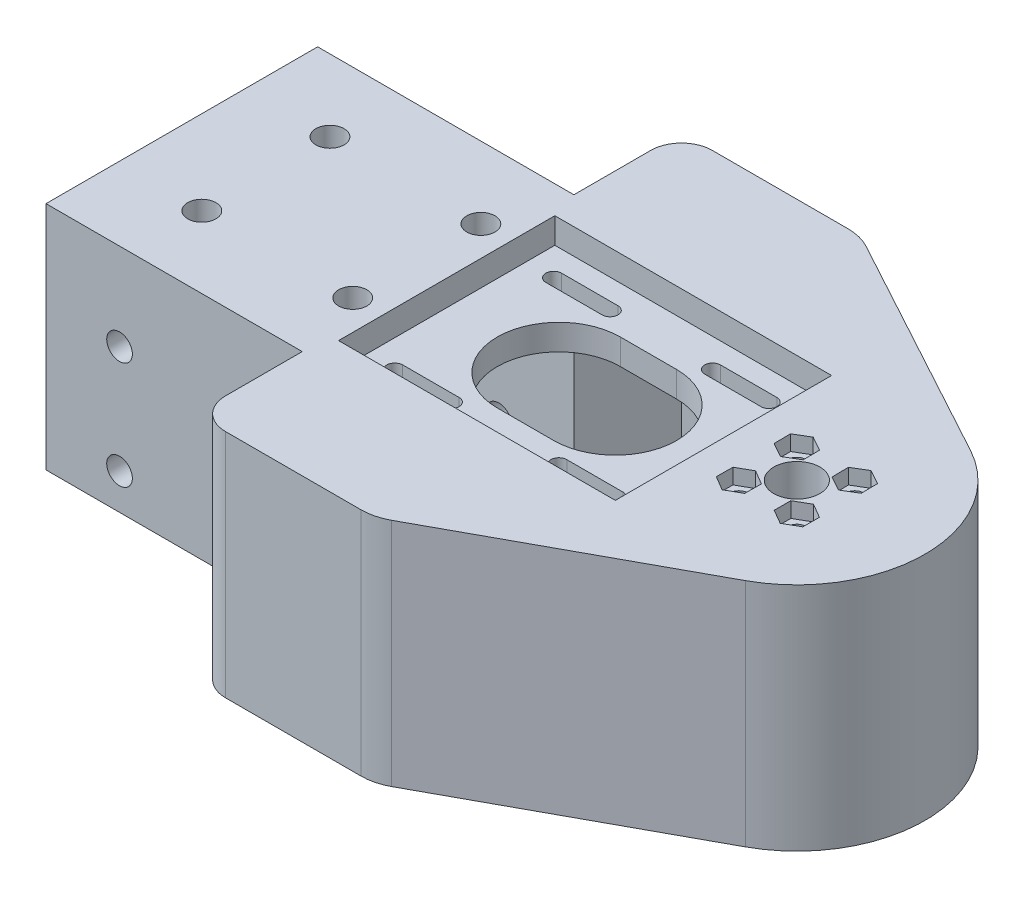
from build123d import *

# Parameters (mm, degrees)
SKETCH1_R           = 4.5
SKETCH1_R_2         = 1.75
BOSS_EXTRUDE1_DEPTH = 10
EXTRUDE_THIN1_START = 35
EXTRUDE_THIN1_DEPTH = 35
FILLET2_R           = 6
EXTRUDE_THIN2_DEPTH = 35
SKETCH7_R           = 2.5
CUT_EXTRUDE2_DEPTH  = 10
CUT_EXTRUDE13_DEPTH = 3
CUT_EXTRUDE5_REACH  = 107.472
SKETCH12_R          = 2.75
CUT_EXTRUDE6_DEPTH  = 2
SKETCH14_W          = 54
SKETCH14_H          = 42.2
CUT_EXTRUDE7_DEPTH  = 5
CUT_EXTRUDE8_REACH  = 105.437
CUT_EXTRUDE10_REACH = 158.545
SKETCH17_W          = 19
SKETCH17_H          = 25
CUT_EXTRUDE12_REACH = 158.545
SKETCH18_R          = 2.55
SKETCH23_R          = 5.5
CUT_EXTRUDE14_DEPTH = 1
CUT_EXTRUDE15_START = -1
SKETCH25_R          = 5.5
CUT_EXTRUDE15_DEPTH = 1
SKETCH26_W          = 10
SKETCH26_H          = 4
BOSS_EXTRUDE2_DEPTH = 7
SKETCH27_W          = 10
SKETCH27_H          = 3
BOSS_EXTRUDE3_DEPTH = 5
CUT_EXTRUDE17_REACH = 128.312
SKETCH29_W          = 20
SKETCH29_H          = 10


with BuildPart() as part:
    # Sketch1 → Boss-Extrude1 (new body)
    with BuildSketch(Plane(origin=(0, 0, 0), x_dir=(1, 0, 0), z_dir=(0, 1, 0))):
        with BuildLine():
            Line((-62.277372263, 21.5), (-62.277372263, -21.5))
            Line((-62.277372263, -21.5), (-62.277372263, -26.5))
            Line((-62.277372263, -26.5), (-57.277372263, -26.5))
            Line((-57.277372263, -26.5), (-12.277372263, -26.5))
            Line((-12.277372263, -26.5), (-12.277372263, -31.5))
            Line((-12.277372263, -31.5), (-12.277372263, -42.5))
            ThreePointArc((-12.277372263, -42.5), (-10.812906169, -46.035533906), (-7.277372263, -47.5))
            Line((-7.277372263, -47.5), (20.178642107, -47.5))
            ThreePointArc((20.178642107, -47.5), (22.644097944, -47.191311961), (24.957342434, -46.284305504))
            Line((24.957342434, -46.284305504), (69.669378554, -21.96076376))
            ThreePointArc((69.669378554, -21.96076376), (82.722627737, 0), (69.669378554, 21.96076376))
            Line((69.669378554, 21.96076376), (24.957342434, 46.284305504))
            ThreePointArc((24.957342434, 46.284305504), (22.644097944, 47.191311961), (20.178642107, 47.5))
            Line((20.178642107, 47.5), (-7.277372263, 47.5))
            ThreePointArc((-7.277372263, 47.5), (-10.812906169, 46.035533906), (-12.277372263, 42.5))
            Line((-12.277372263, 42.5), (-12.277372263, 31.5))
            Line((-12.277372263, 31.5), (-12.277372263, 26.5))
            Line((-12.277372263, 26.5), (-17.277372263, 26.5))
            Line((-17.277372263, 26.5), (-57.277372263, 26.5))
            Line((-57.277372263, 26.5), (-62.277372263, 26.5))
            Line((-62.277372263, 26.5), (-62.277372263, 21.5))
        make_face()
        with Locations(Location((57.722627737, 0, 0), (0, 0, 270))):
            Circle(SKETCH1_R, mode=Mode.SUBTRACT)
        with Locations(Location((52.065773488, -5.656854249, 0), (0, 0, 270))):
            Circle(SKETCH1_R_2, mode=Mode.SUBTRACT)
        with Locations(Location((63.379481987, 5.656854249, 0), (0, 0, 270))):
            Circle(SKETCH1_R_2, mode=Mode.SUBTRACT)
        with Locations(Location((52.065773488, 5.656854249, 0), (0, 0, 270))):
            Circle(SKETCH1_R_2, mode=Mode.SUBTRACT)
        with Locations(Location((63.379481987, -5.656854249, 0), (0, 0, 270))):
            Circle(SKETCH1_R_2, mode=Mode.SUBTRACT)
    extrude(amount=BOSS_EXTRUDE1_DEPTH)

    # Sketch5 → Extrude-Thin1 (add)
    with BuildSketch(Plane.XZ.offset(EXTRUDE_THIN1_START)):
        with BuildLine():
            Line((20.178642107, 47.5), (-12.277372263, 47.5))
            Line((-12.277372263, 47.5), (-12.277372263, 26.5))
            Line((-12.277372263, 26.5), (-62.277372263, 26.5))
            Line((-62.277372263, 26.5), (-62.277372263, -26.5))
            Line((-62.277372263, -26.5), (-12.277372263, -26.5))
            Line((-12.277372263, -26.5), (-12.277372263, -47.5))
            Line((-12.277372263, -47.5), (20.178642107, -47.5))
            ThreePointArc((20.178642107, -47.5), (22.644097944, -47.191311961), (24.957342434, -46.284305504))
            Line((24.957342434, -46.284305504), (69.669378554, -21.96076376))
            ThreePointArc((69.669378554, -21.96076376), (82.722627737, 0), (69.669378554, 21.96076376))
            Line((69.669378554, 21.96076376), (24.957342434, 46.284305504))
            ThreePointArc((24.957342434, 46.284305504), (22.644097944, 47.191311961), (20.178642107, 47.5))
        make_face()
        with BuildLine():
            Line((20.178642107, 42.5), (-7.277372263, 42.5))
            Line((-7.277372263, 42.5), (-7.277372263, 21.5))
            Line((-7.277372263, 21.5), (-57.277372263, 21.5))
            Line((-57.277372263, 21.5), (-57.277372263, -21.5))
            Line((-57.277372263, -21.5), (-7.277372263, -21.5))
            Line((-7.277372263, -21.5), (-7.277372263, -42.5))
            Line((-7.277372263, -42.5), (20.178642107, -42.5))
            ThreePointArc((20.178642107, -42.5), (21.411370026, -42.34565598), (22.567992271, -41.892152752))
            Line((22.567992271, -41.892152752), (67.280028391, -17.568611008))
            ThreePointArc((67.280028391, -17.568611008), (77.722627737, 0), (67.280028391, 17.568611008))
            Line((67.280028391, 17.568611008), (22.567992271, 41.892152752))
            ThreePointArc((22.567992271, 41.892152752), (21.411370026, 42.34565598), (20.178642107, 42.5))
        make_face(mode=Mode.SUBTRACT)
    extrude(amount=-EXTRUDE_THIN1_DEPTH)

    # Fillet2
    fillet2_edges = [part.edges().sort_by_distance(p)[0] for p in [
        (-12.277372263, -17.5, -47.5),
        (-12.277372263, -17.5, 47.5),
    ]]
    fillet(fillet2_edges, radius=FILLET2_R)

    # Sketch11 → Extrude-Thin2 (add)
    with BuildSketch(Plane.XZ):
        with BuildLine():
            Line((23.045862303, -42.770583302), (67.757898423, -18.447041558))
            ThreePointArc((67.757898423, -18.447041558), (78.722627737, 0), (67.757898423, 18.447041558))
            Line((67.757898423, 18.447041558), (23.045862303, 42.770583302))
            ThreePointArc((23.045862303, 42.770583302), (21.657915609, 43.314787176), (20.178642107, 43.5))
            Line((20.178642107, 43.5), (-8.277372263, 43.5))
            Line((-8.277372263, 43.5), (-8.277372263, 22.5))
            Line((-8.277372263, 22.5), (-58.277372263, 22.5))
            Line((-58.277372263, 22.5), (-58.277372263, -22.5))
            Line((-58.277372263, -22.5), (-8.277372263, -22.5))
            Line((-8.277372263, -22.5), (-8.277372263, -43.5))
            Line((-8.277372263, -43.5), (20.178642107, -43.5))
            ThreePointArc((20.178642107, -43.5), (21.657915609, -43.314787176), (23.045862303, -42.770583302))
        make_face()
        with BuildLine():
            Line((21.612252205, -40.135291651), (66.324288325, -15.811749907))
            ThreePointArc((66.324288325, -15.811749907), (75.722627737, 0), (66.324288325, 15.811749907))
            Line((66.324288325, 15.811749907), (21.612252205, 40.135291651))
            ThreePointArc((21.612252205, 40.135291651), (20.918278858, 40.407393588), (20.178642107, 40.5))
            Line((20.178642107, 40.5), (-5.277372263, 40.5))
            Line((-5.277372263, 40.5), (-5.277372263, 19.5))
            Line((-5.277372263, 19.5), (-55.277372263, 19.5))
            Line((-55.277372263, 19.5), (-55.277372263, -19.5))
            Line((-55.277372263, -19.5), (-5.277372263, -19.5))
            Line((-5.277372263, -19.5), (-5.277372263, -40.5))
            Line((-5.277372263, -40.5), (20.178642107, -40.5))
            ThreePointArc((20.178642107, -40.5), (20.918278858, -40.407393588), (21.612252205, -40.135291651))
        make_face(mode=Mode.SUBTRACT)
    extrude(amount=EXTRUDE_THIN2_DEPTH)

    # Sketch7 → Cut-Extrude2 (cut)
    with BuildSketch(Plane.XY.offset(26.5)):
        with Locations((-47.928886162, -7)):
            Circle(SKETCH7_R)
        with Locations((-19.928886162, -7)):
            Circle(SKETCH7_R)
        with Locations((-19.928886162, -28)):
            Circle(SKETCH7_R)
        with Locations((-47.928886162, -28)):
            Circle(SKETCH7_R)
    cut_extrude2 = extrude(amount=-CUT_EXTRUDE2_DEPTH, mode=Mode.SUBTRACT)

    # Sketch20 → Cut-Extrude13 (cut)
    with BuildSketch(Plane(origin=(0, 10, 0), x_dir=(1, 0, 0), z_dir=(0, 1, 0))):
        Polygon((54.883770249, -4.071853433), (52.102120896, -2.423897058), (49.284124135, -4.008897875), (49.247776727, -7.241855066), (52.029426079, -8.889811441), (54.84742284, -7.304810624), align=None)
        Polygon((54.886163374, 4.076115743), (54.844928134, 7.309014286), (52.024538248, 8.889752792), (49.245383602, 7.237592756), (49.286618842, 4.004694213), (52.107008727, 2.423955707), align=None)
        Polygon((66.174942402, -7.281272422), (66.183999598, -4.048123601), (63.388539183, -2.423705428), (60.584021571, -4.032436077), (60.574964375, -7.265584898), (63.370424791, -8.890003071), align=None)
        Polygon((66.204140036, 4.083755321), (66.154154646, 7.316530412), (63.329496597, 8.889629341), (60.554823938, 7.229953178), (60.604809327, 3.997178087), (63.429467376, 2.424079158), align=None)
    extrude(amount=-CUT_EXTRUDE13_DEPTH, mode=Mode.SUBTRACT)

    # Mirror1: Cut-Extrude2 across plane
    add(cut_extrude2.mirror(Plane.XY), mode=Mode.SUBTRACT)

    # Sketch12 → Cut-Extrude5 (cut, up to next)
    with BuildSketch(Plane(origin=(0, 10, 0), x_dir=(1, 0, 0), z_dir=(0, 1, 0)), mode=Mode.PRIVATE) as cut_extrude5_sk1:
        with Locations(Location((-45.872097388, -12.5, 0), (0, 0, 270))):
            Circle(SKETCH12_R)
    cut_extrude5_tool1 = extrude(cut_extrude5_sk1.sketch, amount=-CUT_EXTRUDE5_REACH, mode=Mode.PRIVATE) & part.part
    # Sketch12 → Cut-Extrude5 (cut, up to next)
    with BuildSketch(Plane(origin=(0, 10, 0), x_dir=(1, 0, 0), z_dir=(0, 1, 0)), mode=Mode.PRIVATE) as cut_extrude5_sk2:
        with Locations(Location((-45.872097388, 12.5, 0), (0, 0, 270))):
            Circle(SKETCH12_R)
    cut_extrude5_tool2 = extrude(cut_extrude5_sk2.sketch, amount=-CUT_EXTRUDE5_REACH, mode=Mode.PRIVATE) & part.part
    # Sketch12 → Cut-Extrude5 (cut, up to next)
    with BuildSketch(Plane(origin=(0, 10, 0), x_dir=(1, 0, 0), z_dir=(0, 1, 0)), mode=Mode.PRIVATE) as cut_extrude5_sk3:
        with Locations(Location((-16.428886162, 12.5, 0), (0, 0, 270))):
            Circle(SKETCH12_R)
    cut_extrude5_tool3 = extrude(cut_extrude5_sk3.sketch, amount=-CUT_EXTRUDE5_REACH, mode=Mode.PRIVATE) & part.part
    # Sketch12 → Cut-Extrude5 (cut, up to next)
    with BuildSketch(Plane(origin=(0, 10, 0), x_dir=(1, 0, 0), z_dir=(0, 1, 0)), mode=Mode.PRIVATE) as cut_extrude5_sk4:
        with Locations(Location((-16.428886162, -12.5, 0), (0, 0, 270))):
            Circle(SKETCH12_R)
    cut_extrude5_tool4 = extrude(cut_extrude5_sk4.sketch, amount=-CUT_EXTRUDE5_REACH, mode=Mode.PRIVATE) & part.part
    add(cut_extrude5_tool1.solids().sort_by_distance((-45.872097, 10, 12.5))[0], mode=Mode.SUBTRACT)
    add(cut_extrude5_tool2.solids().sort_by_distance((-45.872097, 10, -12.5))[0], mode=Mode.SUBTRACT)
    add(cut_extrude5_tool3.solids().sort_by_distance((-16.428886, 10, -12.5))[0], mode=Mode.SUBTRACT)
    add(cut_extrude5_tool4.solids().sort_by_distance((-16.428886, 10, 12.5))[0], mode=Mode.SUBTRACT)

    # Sketch13 → Cut-Extrude6 (cut)
    with BuildSketch(Plane.XZ):
        Polygon((-41.71299775, -9.895153837), (-46.048410519, -7.595690975), (-50.207510158, -10.200537138), (-50.031197027, -15.104846163), (-45.695784258, -17.404309025), (-41.536684619, -14.799462862), align=None)
        Polygon((-41.707422273, 9.904077329), (-41.541624851, 14.808753113), (-45.706299967, 17.404675784), (-50.036772504, 15.095922671), (-50.202569926, 10.191246887), (-46.03789481, 7.595324216), align=None)
        Polygon((-12.294164258, -9.856629404), (-16.650751298, -7.597540495), (-20.785473202, -10.240911091), (-20.563608066, -15.143370596), (-16.207021026, -17.402459505), (-12.072299122, -14.759088909), align=None)
        Polygon((-12.297399032, 9.851576425), (-12.069540501, 14.753761022), (-16.201027631, 17.402184597), (-20.560373291, 15.148423575), (-20.788231822, 10.246238978), (-16.656744693, 7.597815403), align=None)
    extrude(amount=-CUT_EXTRUDE6_DEPTH, mode=Mode.SUBTRACT)

    # Sketch14 → Cut-Extrude7 (cut)
    with BuildSketch(Plane(origin=(0, 10, 0), x_dir=(1, 0, 0), z_dir=(0, 1, 0))):
        with Locations((16.406183675, 0)):
            Rectangle(SKETCH14_W, SKETCH14_H)
    extrude(amount=-CUT_EXTRUDE7_DEPTH, mode=Mode.SUBTRACT)

    # Sketch15 → Cut-Extrude8 (cut, up to next)
    with BuildSketch(Plane(origin=(0, 5, 0), x_dir=(1, 0, 0), z_dir=(0, 1, 0)), mode=Mode.PRIVATE) as cut_extrude8_sk1:
        with BuildLine():
            Line((11.280161919, 12), (22.280161919, 12))
            ThreePointArc((22.280161919, 12), (34.280161919, 0), (22.280161919, -12))
            Line((22.280161919, -12), (11.280161919, -12))
            ThreePointArc((11.280161919, -12), (-0.719838081, 0), (11.280161919, 12))
        make_face()
    cut_extrude8_tool1 = extrude(cut_extrude8_sk1.sketch, amount=-CUT_EXTRUDE8_REACH, mode=Mode.PRIVATE) & part.part
    # Sketch15 → Cut-Extrude8 (cut, up to next)
    with BuildSketch(Plane(origin=(0, 5, 0), x_dir=(1, 0, 0), z_dir=(0, 1, 0)), mode=Mode.PRIVATE) as cut_extrude8_sk2:
        with BuildLine():
            Line((26.780161919, -13.95), (37.780161919, -13.95))
            ThreePointArc((37.780161919, -13.95), (39.330161919, -15.5), (37.780161919, -17.05))
            Line((37.780161919, -17.05), (26.780161919, -17.05))
            ThreePointArc((26.780161919, -17.05), (25.230161919, -15.5), (26.780161919, -13.95))
        make_face()
    cut_extrude8_tool2 = extrude(cut_extrude8_sk2.sketch, amount=-CUT_EXTRUDE8_REACH, mode=Mode.PRIVATE) & part.part
    # Sketch15 → Cut-Extrude8 (cut, up to next)
    with BuildSketch(Plane(origin=(0, 5, 0), x_dir=(1, 0, 0), z_dir=(0, 1, 0)), mode=Mode.PRIVATE) as cut_extrude8_sk3:
        with BuildLine():
            Line((-5.219838081, -13.95), (5.780161919, -13.95))
            ThreePointArc((5.780161919, -13.95), (7.330161919, -15.5), (5.780161919, -17.05))
            Line((5.780161919, -17.05), (-5.219838081, -17.05))
            ThreePointArc((-5.219838081, -17.05), (-6.769838081, -15.5), (-5.219838081, -13.95))
        make_face()
    cut_extrude8_tool3 = extrude(cut_extrude8_sk3.sketch, amount=-CUT_EXTRUDE8_REACH, mode=Mode.PRIVATE) & part.part
    # Sketch15 → Cut-Extrude8 (cut, up to next)
    with BuildSketch(Plane(origin=(0, 5, 0), x_dir=(1, 0, 0), z_dir=(0, 1, 0)), mode=Mode.PRIVATE) as cut_extrude8_sk4:
        with BuildLine():
            Line((-5.219838081, 17.05), (5.780161919, 17.05))
            ThreePointArc((5.780161919, 17.05), (7.330161919, 15.5), (5.780161919, 13.95))
            Line((5.780161919, 13.95), (-5.219838081, 13.95))
            ThreePointArc((-5.219838081, 13.95), (-6.769838081, 15.5), (-5.219838081, 17.05))
        make_face()
    cut_extrude8_tool4 = extrude(cut_extrude8_sk4.sketch, amount=-CUT_EXTRUDE8_REACH, mode=Mode.PRIVATE) & part.part
    # Sketch15 → Cut-Extrude8 (cut, up to next)
    with BuildSketch(Plane(origin=(0, 5, 0), x_dir=(1, 0, 0), z_dir=(0, 1, 0)), mode=Mode.PRIVATE) as cut_extrude8_sk5:
        with BuildLine():
            Line((25.780161919, 17.05), (36.780161919, 17.05))
            ThreePointArc((36.780161919, 17.05), (38.330161919, 15.5), (36.780161919, 13.95))
            Line((36.780161919, 13.95), (25.780161919, 13.95))
            ThreePointArc((25.780161919, 13.95), (24.230161919, 15.5), (25.780161919, 17.05))
        make_face()
    cut_extrude8_tool5 = extrude(cut_extrude8_sk5.sketch, amount=-CUT_EXTRUDE8_REACH, mode=Mode.PRIVATE) & part.part
    add(cut_extrude8_tool1.solids().sort_by_distance((16.780162, 5, 0))[0], mode=Mode.SUBTRACT)
    add(cut_extrude8_tool2.solids().sort_by_distance((32.280162, 5, 15.5))[0], mode=Mode.SUBTRACT)
    add(cut_extrude8_tool3.solids().sort_by_distance((0.280162, 5, 15.5))[0], mode=Mode.SUBTRACT)
    add(cut_extrude8_tool4.solids().sort_by_distance((0.280162, 5, -15.5))[0], mode=Mode.SUBTRACT)
    add(cut_extrude8_tool5.solids().sort_by_distance((31.280162, 5, -15.5))[0], mode=Mode.SUBTRACT)

    # Sketch17 → Cut-Extrude10 (cut, up to next)
    with BuildSketch(Plane.ZY.offset(62.277372263), mode=Mode.PRIVATE) as cut_extrude10_sk1:
        with Locations((0, -12.5)):
            Rectangle(SKETCH17_W, SKETCH17_H)
    cut_extrude10_tool1 = extrude(cut_extrude10_sk1.sketch, amount=-CUT_EXTRUDE10_REACH, mode=Mode.PRIVATE) & part.part
    add(cut_extrude10_tool1.solids().sort_by_distance((-62.277372, -12.5, 0))[0], mode=Mode.SUBTRACT)

    # Sketch18 → Cut-Extrude12 (cut, up to next)
    with BuildSketch(Plane.ZY.offset(62.277372263), mode=Mode.PRIVATE) as cut_extrude12_sk1:
        with Locations((-14.5, -6.25)):
            Circle(SKETCH18_R)
    cut_extrude12_tool1 = extrude(cut_extrude12_sk1.sketch, amount=-CUT_EXTRUDE12_REACH, mode=Mode.PRIVATE) & part.part
    # Sketch18 → Cut-Extrude12 (cut, up to next)
    with BuildSketch(Plane.ZY.offset(62.277372263), mode=Mode.PRIVATE) as cut_extrude12_sk2:
        with Locations((-14.5, -18.75)):
            Circle(SKETCH18_R)
    cut_extrude12_tool2 = extrude(cut_extrude12_sk2.sketch, amount=-CUT_EXTRUDE12_REACH, mode=Mode.PRIVATE) & part.part
    # Sketch18 → Cut-Extrude12 (cut, up to next)
    with BuildSketch(Plane.ZY.offset(62.277372263), mode=Mode.PRIVATE) as cut_extrude12_sk3:
        with Locations((14.5, -6.25)):
            Circle(SKETCH18_R)
    cut_extrude12_tool3 = extrude(cut_extrude12_sk3.sketch, amount=-CUT_EXTRUDE12_REACH, mode=Mode.PRIVATE) & part.part
    # Sketch18 → Cut-Extrude12 (cut, up to next)
    with BuildSketch(Plane.ZY.offset(62.277372263), mode=Mode.PRIVATE) as cut_extrude12_sk4:
        with Locations((14.5, -18.75)):
            Circle(SKETCH18_R)
    cut_extrude12_tool4 = extrude(cut_extrude12_sk4.sketch, amount=-CUT_EXTRUDE12_REACH, mode=Mode.PRIVATE) & part.part
    add(cut_extrude12_tool1.solids().sort_by_distance((-62.277372, -6.25, -14.5))[0], mode=Mode.SUBTRACT)
    add(cut_extrude12_tool2.solids().sort_by_distance((-62.277372, -18.75, -14.5))[0], mode=Mode.SUBTRACT)
    add(cut_extrude12_tool3.solids().sort_by_distance((-62.277372, -6.25, 14.5))[0], mode=Mode.SUBTRACT)
    add(cut_extrude12_tool4.solids().sort_by_distance((-62.277372, -18.75, 14.5))[0], mode=Mode.SUBTRACT)

    # Sketch23 → Cut-Extrude14 (cut)
    with BuildSketch(Plane.XY.offset(-19.5)):
        with Locations((-47.928886162, -7)):
            Circle(SKETCH23_R)
        with Locations((-47.928886162, -28)):
            Circle(SKETCH23_R)
    extrude(amount=-CUT_EXTRUDE14_DEPTH, mode=Mode.SUBTRACT)

    # Sketch25 → Cut-Extrude15 (cut)
    with BuildSketch(Plane(origin=(0, 0, 19.5), x_dir=(-1, 0, 0), z_dir=(0, 0, -1)).offset(CUT_EXTRUDE15_START)):
        with Locations(Location((47.928886162, -7, 0), (0, 0, 180))):
            Circle(SKETCH25_R)
        with Locations(Location((47.928886162, -28, 0), (0, 0, 180))):
            Circle(SKETCH25_R)
    extrude(amount=CUT_EXTRUDE15_DEPTH, mode=Mode.SUBTRACT)

    # Sketch26 → Boss-Extrude2 (add)
    with BuildSketch(Plane.XY.offset(-19.5)):
        with Locations((-33.004246463, -23.803831635)):
            Rectangle(SKETCH26_W, SKETCH26_H)
    extrude(amount=BOSS_EXTRUDE2_DEPTH)

    # Sketch27 → Boss-Extrude3 (add)
    with BuildSketch(Plane(origin=(0, -21.803831635, 0), x_dir=(1, 0, 0), z_dir=(0, 1, 0))):
        with Locations((-33.004246463, 14)):
            Rectangle(SKETCH27_W, SKETCH27_H)
    extrude(amount=BOSS_EXTRUDE3_DEPTH)

    # Sketch29 → Cut-Extrude17 (cut, up to next)
    with BuildSketch(Plane(origin=(21.783186474, 0, -40.042302667), x_dir=(0.878430550395058, 0, 0.4778700326790071), z_dir=(-0.47787003267900713, 0, 0.8784305503950581)), mode=Mode.PRIVATE) as cut_extrude17_sk1:
        with Locations((20.520923402, -20.803831635)):
            Rectangle(SKETCH29_W, SKETCH29_H)
    cut_extrude17_tool1 = extrude(cut_extrude17_sk1.sketch, amount=-CUT_EXTRUDE17_REACH, mode=Mode.PRIVATE) & part.part
    add(cut_extrude17_tool1.solids().sort_by_distance((39.809393, -20.803832, -30.235968))[0], mode=Mode.SUBTRACT)


solid = part.part
